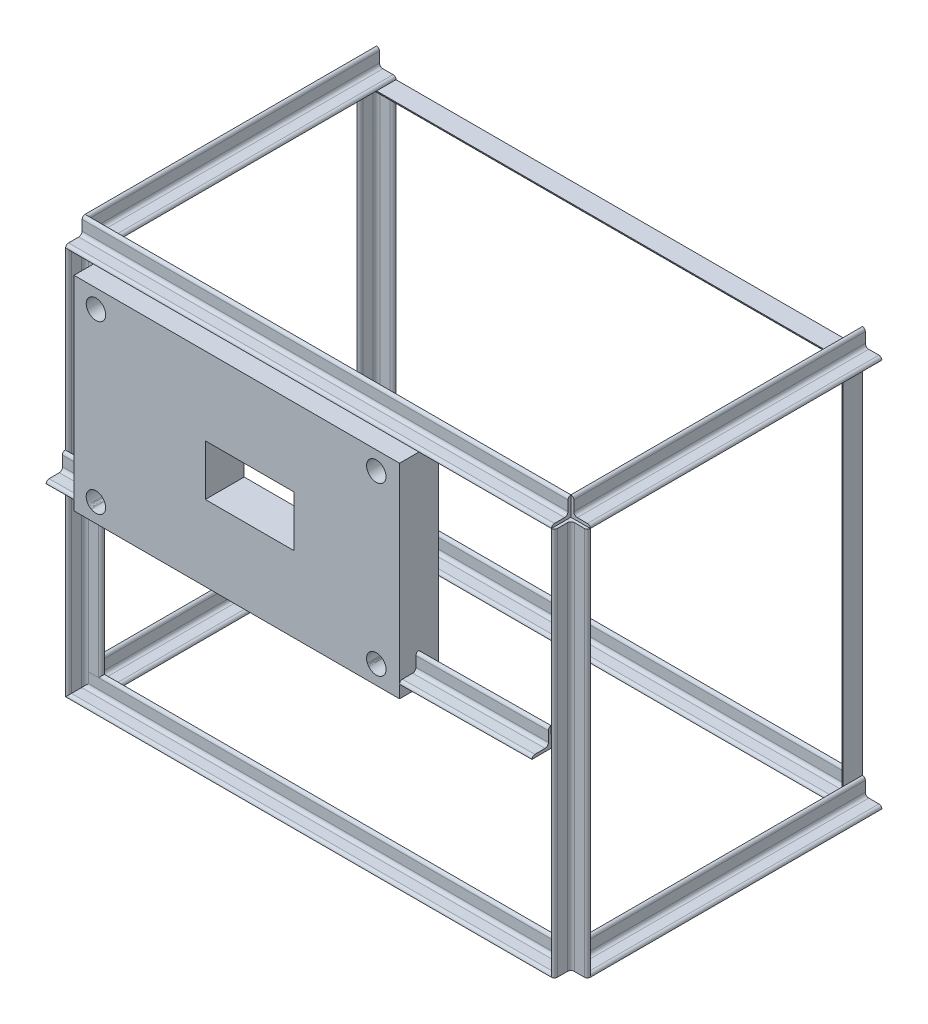
from build123d import *

# Parameters (mm, degrees)
BOSS_EXTRUDE2_DEPTH                 = 40
SKETCH113_W                         = 91.238895614
SKETCH113_H                         = 52.316287701
CUT_EXTRUDE2_DEPTH                  = 40
ANGLE_IRON_20_X_20_X_3_1_DEPTH      = 400
ANGLE_IRON_20_X_20_X_3_1_2_DEPTH    = 400
ANGLE_IRON_20_X_20_X_3_2_DEPTH      = 500
ANGLE_IRON_20_X_20_X_3_2_2_DEPTH    = 500
ANGLE_IRON_20_X_20_X_3_3_DEPTH      = 300
ANGLE_IRON_20_X_20_X_3_3_2_DEPTH    = 300
ANGLE_IRON_20_X_20_X_3_3_3_DEPTH    = 300
ANGLE_IRON_20_X_20_X_3_3_4_DEPTH    = 300
ANGLE_IRON_20_X_20_X_3_4_DEPTH      = 429.284271247
ANGLE_IRON_20_X_20_X_3_4_DEPTH_BACK = 29.284271247
ANGLE_IRON_20_X_20_X_3_4_2_DEPTH    = 558.568542495
ANGLE_IRON_20_X_20_X_3_4_3_DEPTH    = 458.568542495
ANGLE_IRON_20_X_20_X_3_4_4_DEPTH    = 558.568542495
ANGLE_IRON_20_X_20_X_3_5_DEPTH      = 500.019043786
SKETCH111_R                         = 10
CUT_EXTRUDE3_DEPTH                  = 40


with BuildPart() as part:
    # 3DSketch6 → Boss-Extrude2 (new body)
    with BuildSketch(Plane(origin=(-221.334892631, 200, 300), x_dir=(0.8472870884199184, -0.5311351897557696, 0), z_dir=(0, 0, 1))):
        Polygon((0, 0), (283.841174621, 177.930288568), (395.379564469, 0), (111.538389849, -177.930288568), align=None)
    extrude(amount=BOSS_EXTRUDE2_DEPTH)

    # Sketch113 → Cut-Extrude2 (cut)
    with BuildSketch(Plane.XY.offset(340)):
        with Locations((-40.583534737, 93.904967239)):
            Rectangle(SKETCH113_W, SKETCH113_H)
    extrude(amount=-CUT_EXTRUDE2_DEPTH, mode=Mode.SUBTRACT)


with BuildPart() as body_2:
    # Sketch128 → Angle iron 20 X 20 X 3(1) (new body)
    with BuildSketch(Plane(origin=(-250, 200, 300), x_dir=(1, 0, 0), z_dir=(0, -1, 0))):
        with BuildLine():
            Line((0, 0), (0, 20))
            ThreePointArc((0, 20), (2.121320344, 19.121320344), (3, 17))
            Line((3, 17), (3, 6.5))
            ThreePointArc((3, 6.5), (4.025126266, 4.025126266), (6.5, 3))
            Line((6.5, 3), (17, 3))
            ThreePointArc((17, 3), (19.121320344, 2.121320344), (20, 0))
            Line((20, 0), (0, 0))
        make_face()
    extrude(amount=ANGLE_IRON_20_X_20_X_3_1_DEPTH)


with BuildPart() as body_3:
    # Sketch128 on segment 2 (carried to segment 2) → Angle iron 20 X 20 X 3_1 2 (new body)
    with BuildSketch(Plane(origin=(250, 200, 300), x_dir=(1, 0, 0), z_dir=(0, -1, 0))):
        with BuildLine():
            Line((0, 0), (0, 20))
            ThreePointArc((0, 20), (2.121320344, 19.121320344), (3, 17))
            Line((3, 17), (3, 6.5))
            ThreePointArc((3, 6.5), (4.025126266, 4.025126266), (6.5, 3))
            Line((6.5, 3), (17, 3))
            ThreePointArc((17, 3), (19.121320344, 2.121320344), (20, 0))
            Line((20, 0), (0, 0))
        make_face()
    extrude(amount=ANGLE_IRON_20_X_20_X_3_1_2_DEPTH)


with BuildPart() as body_4:
    # Sketch129 → Angle iron 20 X 20 X 3(2) (new body)
    with BuildSketch(Plane(origin=(250, 200, 300), x_dir=(0, 0, 1), z_dir=(-1, 0, 0))):
        with BuildLine():
            Line((0, 0), (0, 20))
            ThreePointArc((0, 20), (2.121320344, 19.121320344), (3, 17))
            Line((3, 17), (3, 6.5))
            ThreePointArc((3, 6.5), (4.025126266, 4.025126266), (6.5, 3))
            Line((6.5, 3), (17, 3))
            ThreePointArc((17, 3), (19.121320344, 2.121320344), (20, 0))
            Line((20, 0), (0, 0))
        make_face()
    extrude(amount=ANGLE_IRON_20_X_20_X_3_2_DEPTH)


with BuildPart() as body_5:
    # Sketch129 on segment 2 (carried to segment 2) → Angle iron 20 X 20 X 3_2 2 (new body)
    with BuildSketch(Plane(origin=(250, -200, 300), x_dir=(0, 0, 1), z_dir=(-1, 0, 0))):
        with BuildLine():
            Line((0, 0), (0, 20))
            ThreePointArc((0, 20), (2.121320344, 19.121320344), (3, 17))
            Line((3, 17), (3, 6.5))
            ThreePointArc((3, 6.5), (4.025126266, 4.025126266), (6.5, 3))
            Line((6.5, 3), (17, 3))
            ThreePointArc((17, 3), (19.121320344, 2.121320344), (20, 0))
            Line((20, 0), (0, 0))
        make_face()
    extrude(amount=ANGLE_IRON_20_X_20_X_3_2_2_DEPTH)


with BuildPart() as body_6:
    # Sketch130 → Angle iron 20 X 20 X 3(3) (new body)
    with BuildSketch(Plane(origin=(-250, 200, 0), x_dir=(1, 0, 0), z_dir=(0, 0, 1))):
        with BuildLine():
            Line((0, 0), (0, 20))
            ThreePointArc((0, 20), (2.121320344, 19.121320344), (3, 17))
            Line((3, 17), (3, 6.5))
            ThreePointArc((3, 6.5), (4.025126266, 4.025126266), (6.5, 3))
            Line((6.5, 3), (17, 3))
            ThreePointArc((17, 3), (19.121320344, 2.121320344), (20, 0))
            Line((20, 0), (0, 0))
        make_face()
    extrude(amount=ANGLE_IRON_20_X_20_X_3_3_DEPTH)


with BuildPart() as body_7:
    # Sketch130 on segment 2 (carried to segment 2) → Angle iron 20 X 20 X 3_3 2 (new body)
    with BuildSketch(Plane(origin=(-250, -200, 0), x_dir=(1, 0, 0), z_dir=(0, 0, 1))):
        with BuildLine():
            Line((0, 0), (0, 20))
            ThreePointArc((0, 20), (2.121320344, 19.121320344), (3, 17))
            Line((3, 17), (3, 6.5))
            ThreePointArc((3, 6.5), (4.025126266, 4.025126266), (6.5, 3))
            Line((6.5, 3), (17, 3))
            ThreePointArc((17, 3), (19.121320344, 2.121320344), (20, 0))
            Line((20, 0), (0, 0))
        make_face()
    extrude(amount=ANGLE_IRON_20_X_20_X_3_3_2_DEPTH)


with BuildPart() as body_8:
    # Sketch130 on segment 3 (carried to segment 3) → Angle iron 20 X 20 X 3_3 3 (new body)
    with BuildSketch(Plane(origin=(250, 200, 0), x_dir=(1, 0, 0), z_dir=(0, 0, 1))):
        with BuildLine():
            Line((0, 0), (0, 20))
            ThreePointArc((0, 20), (2.121320344, 19.121320344), (3, 17))
            Line((3, 17), (3, 6.5))
            ThreePointArc((3, 6.5), (4.025126266, 4.025126266), (6.5, 3))
            Line((6.5, 3), (17, 3))
            ThreePointArc((17, 3), (19.121320344, 2.121320344), (20, 0))
            Line((20, 0), (0, 0))
        make_face()
    extrude(amount=ANGLE_IRON_20_X_20_X_3_3_3_DEPTH)


with BuildPart() as body_9:
    # Sketch130 on segment 4 (carried to segment 4) → Angle iron 20 X 20 X 3_3 4 (new body)
    with BuildSketch(Plane(origin=(250, -200, 0), x_dir=(1, 0, 0), z_dir=(0, 0, 1))):
        with BuildLine():
            Line((0, 0), (0, 20))
            ThreePointArc((0, 20), (2.121320344, 19.121320344), (3, 17))
            Line((3, 17), (3, 6.5))
            ThreePointArc((3, 6.5), (4.025126266, 4.025126266), (6.5, 3))
            Line((6.5, 3), (17, 3))
            ThreePointArc((17, 3), (19.121320344, 2.121320344), (20, 0))
            Line((20, 0), (0, 0))
        make_face()
    extrude(amount=ANGLE_IRON_20_X_20_X_3_3_4_DEPTH)


with BuildPart() as body_10:
    # Sketch131 → Angle iron 20 X 20 X 3(4) (new, two sides: drawn at the far end of the back side and taken through both)
    with BuildSketch(Plane(origin=(250, -200, 0), x_dir=(-1, 0, 0), z_dir=(0, 1, 0)).offset(-ANGLE_IRON_20_X_20_X_3_4_DEPTH_BACK)):
        with BuildLine():
            Line((0, 0), (0, 20))
            ThreePointArc((0, 20), (2.121320344, 19.121320344), (3, 17))
            Line((3, 17), (3, 6.5))
            ThreePointArc((3, 6.5), (4.025126266, 4.025126266), (6.5, 3))
            Line((6.5, 3), (17, 3))
            ThreePointArc((17, 3), (19.121320344, 2.121320344), (20, 0))
            Line((20, 0), (0, 0))
        make_face()
    extrude(amount=ANGLE_IRON_20_X_20_X_3_4_DEPTH + ANGLE_IRON_20_X_20_X_3_4_DEPTH_BACK)

    # Angle iron 20 X 20 X 3(4) mitre 1
    split(bisect_by=Plane(origin=(250, -200, 0), x_dir=(-0.707106781, 0.707106781, 0), z_dir=(0.707106781, 0.707106781, 0)), keep=Keep.TOP)

    # Angle iron 20 X 20 X 3(4) mitre 2
    split(bisect_by=Plane(origin=(250, 200, 0), x_dir=(0.707106781, 0.707106781, 0), z_dir=(0.707106781, -0.707106781, 0)), keep=Keep.TOP)


with BuildPart() as body_11:
    # Sketch131 on segment 2 (carried to segment 2) → Angle iron 20 X 20 X 3_4 2 (new body)
    with BuildSketch(Plane(origin=(279.284271247, 200, 0), x_dir=(0, -1, 0), z_dir=(-1, 0, 0))):
        with BuildLine():
            Line((0, 0), (0, 20))
            ThreePointArc((0, 20), (2.121320344, 19.121320344), (3, 17))
            Line((3, 17), (3, 6.5))
            ThreePointArc((3, 6.5), (4.025126266, 4.025126266), (6.5, 3))
            Line((6.5, 3), (17, 3))
            ThreePointArc((17, 3), (19.121320344, 2.121320344), (20, 0))
            Line((20, 0), (0, 0))
        make_face()
    extrude(amount=ANGLE_IRON_20_X_20_X_3_4_2_DEPTH)

    # Angle iron 20 X 20 X 3_4 2 mitre 1
    split(bisect_by=Plane(origin=(250, 200, 0), x_dir=(-0.707106781, -0.707106781, 0), z_dir=(-0.707106781, 0.707106781, 0)), keep=Keep.TOP)

    # Angle iron 20 X 20 X 3_4 2 mitre 2
    split(bisect_by=Plane(origin=(-250, 200, 0), x_dir=(-0.707106781, 0.707106781, 0), z_dir=(0.707106781, 0.707106781, 0)), keep=Keep.TOP)


with BuildPart() as body_12:
    # Sketch131 on segment 3 (carried to segment 3) → Angle iron 20 X 20 X 3_4 3 (new body)
    with BuildSketch(Plane(origin=(-250, 229.284271247, 0), x_dir=(1, 0, 0), z_dir=(0, -1, 0))):
        with BuildLine():
            Line((0, 0), (0, 20))
            ThreePointArc((0, 20), (2.121320344, 19.121320344), (3, 17))
            Line((3, 17), (3, 6.5))
            ThreePointArc((3, 6.5), (4.025126266, 4.025126266), (6.5, 3))
            Line((6.5, 3), (17, 3))
            ThreePointArc((17, 3), (19.121320344, 2.121320344), (20, 0))
            Line((20, 0), (0, 0))
        make_face()
    extrude(amount=ANGLE_IRON_20_X_20_X_3_4_3_DEPTH)

    # Angle iron 20 X 20 X 3_4 3 mitre 1
    split(bisect_by=Plane(origin=(-250, -200, 0), x_dir=(-0.707106781, -0.707106781, 0), z_dir=(-0.707106781, 0.707106781, 0)), keep=Keep.TOP)

    # Angle iron 20 X 20 X 3_4 3 mitre 2
    split(bisect_by=Plane(origin=(-250, 200, 0), x_dir=(0.707106781, -0.707106781, 0), z_dir=(-0.707106781, -0.707106781, 0)), keep=Keep.TOP)


with BuildPart() as body_13:
    # Sketch131 on segment 4 (carried to segment 4) → Angle iron 20 X 20 X 3_4 4 (new body)
    with BuildSketch(Plane(origin=(-279.284271247, -200, 0), x_dir=(0, 1, 0), z_dir=(1, 0, 0))):
        with BuildLine():
            Line((0, 0), (0, 20))
            ThreePointArc((0, 20), (2.121320344, 19.121320344), (3, 17))
            Line((3, 17), (3, 6.5))
            ThreePointArc((3, 6.5), (4.025126266, 4.025126266), (6.5, 3))
            Line((6.5, 3), (17, 3))
            ThreePointArc((17, 3), (19.121320344, 2.121320344), (20, 0))
            Line((20, 0), (0, 0))
        make_face()
    extrude(amount=ANGLE_IRON_20_X_20_X_3_4_4_DEPTH)

    # Angle iron 20 X 20 X 3_4 4 mitre 1
    split(bisect_by=Plane(origin=(250, -200, 0), x_dir=(0.707106781, -0.707106781, 0), z_dir=(-0.707106781, -0.707106781, 0)), keep=Keep.TOP)

    # Angle iron 20 X 20 X 3_4 4 mitre 2
    split(bisect_by=Plane(origin=(-250, -200, 0), x_dir=(0.707106781, 0.707106781, 0), z_dir=(0.707106781, -0.707106781, 0)), keep=Keep.TOP)


with BuildPart() as body_14:
    # Sketch132 → Angle iron 20 X 20 X 3(5) (new body)
    with BuildSketch(Plane(origin=(250, 4.363960202, 320), x_dir=(7.617079214754706e-05, -0.008727255591419944, 0.99996191387865), z_dir=(-0.99996191387865, -0.008727587991395277, 0))):
        with BuildLine():
            Line((0, 0), (0, 20))
            ThreePointArc((0, 20), (2.121320344, 19.121320344), (3, 17))
            Line((3, 17), (3, 6.5))
            ThreePointArc((3, 6.5), (4.025126266, 4.025126266), (6.5, 3))
            Line((6.5, 3), (17, 3))
            ThreePointArc((17, 3), (19.121320344, 2.121320344), (20, 0))
            Line((20, 0), (0, 0))
        make_face()
    extrude(amount=ANGLE_IRON_20_X_20_X_3_5_DEPTH)


with BuildPart() as cut_extrude3_tool:
    # Sketch111 → Cut-Extrude3 (new body)
    with BuildSketch(Plane.XY.offset(340)):
        with Locations((-198.770451158, 9.183135597)):
            Circle(SKETCH111_R)
        with Locations((-198.770451158, 180.996640325)):
            Circle(SKETCH111_R)
        with Locations((89.757744711, 180.996640325)):
            Circle(SKETCH111_R)
        with Locations((89.757744711, 9.183135597)):
            Circle(SKETCH111_R)
    extrude(amount=-CUT_EXTRUDE3_DEPTH)


with BuildPart() as part_1:
    add(part.part)

    # Cut-Extrude3: cut by cut_extrude3_tool
    add(cut_extrude3_tool.part, mode=Mode.SUBTRACT)


with BuildPart() as body_14_1:
    add(body_14.part)

    # Cut-Extrude3: cut by cut_extrude3_tool
    add(cut_extrude3_tool.part, mode=Mode.SUBTRACT)


solid = Compound([body_2.part, body_3.part, body_4.part, body_5.part, body_6.part, body_7.part, body_8.part, body_9.part, body_10.part, body_11.part, body_12.part, body_13.part, part_1.part, body_14_1.part])
